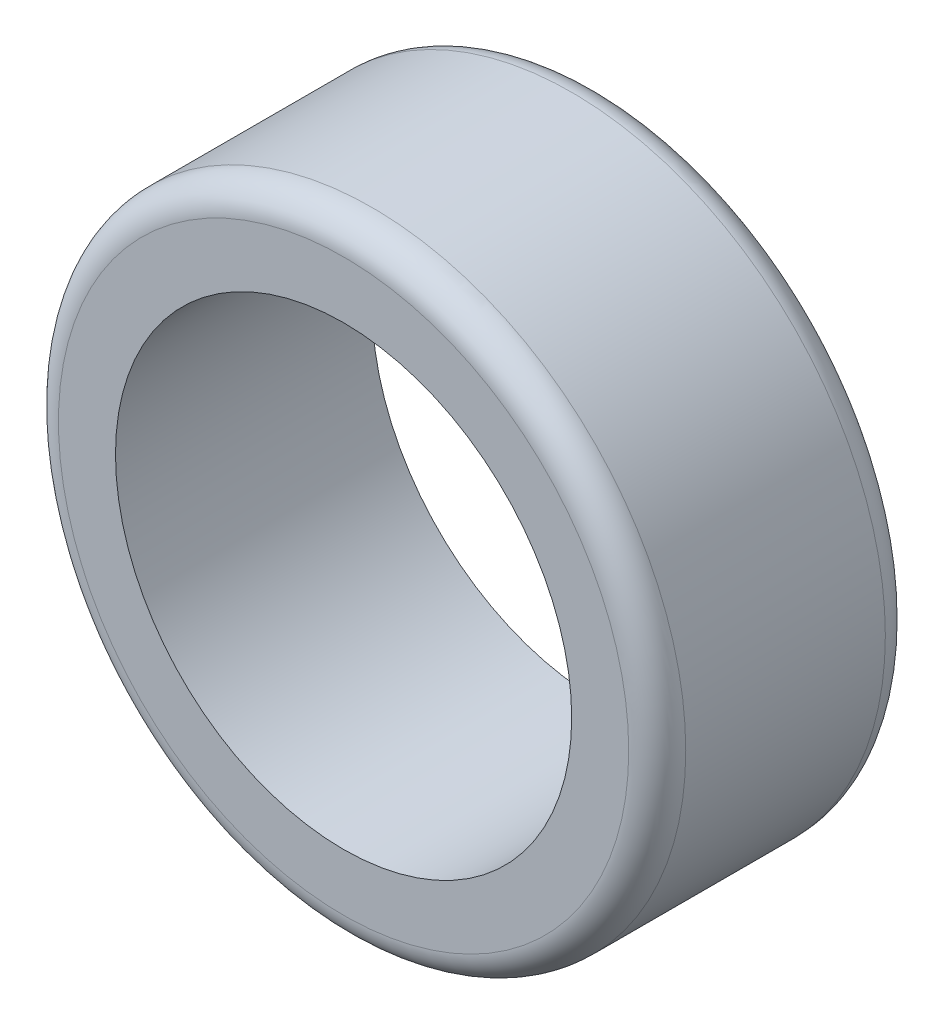
from build123d import *

# Parameters (mm, degrees)
SKETCH1_R           = 11
SKETCH1_R_2         = 8
BOSS_EXTRUDE1_DEPTH = 9
FILLET1_R           = 1


with BuildPart() as part:
    # Sketch1 → Boss-Extrude1 (new body)
    with BuildSketch(Plane.XY):
        Circle(SKETCH1_R)
        Circle(SKETCH1_R_2, mode=Mode.SUBTRACT)
    extrude(amount=BOSS_EXTRUDE1_DEPTH)

    # Fillet1
    fillet1_edges = [part.edges().sort_by_distance(p)[0] for p in [
        (-11, 0, 0),
        (-11, 0, 9),
    ]]
    fillet(fillet1_edges, radius=FILLET1_R)


solid = part.part
